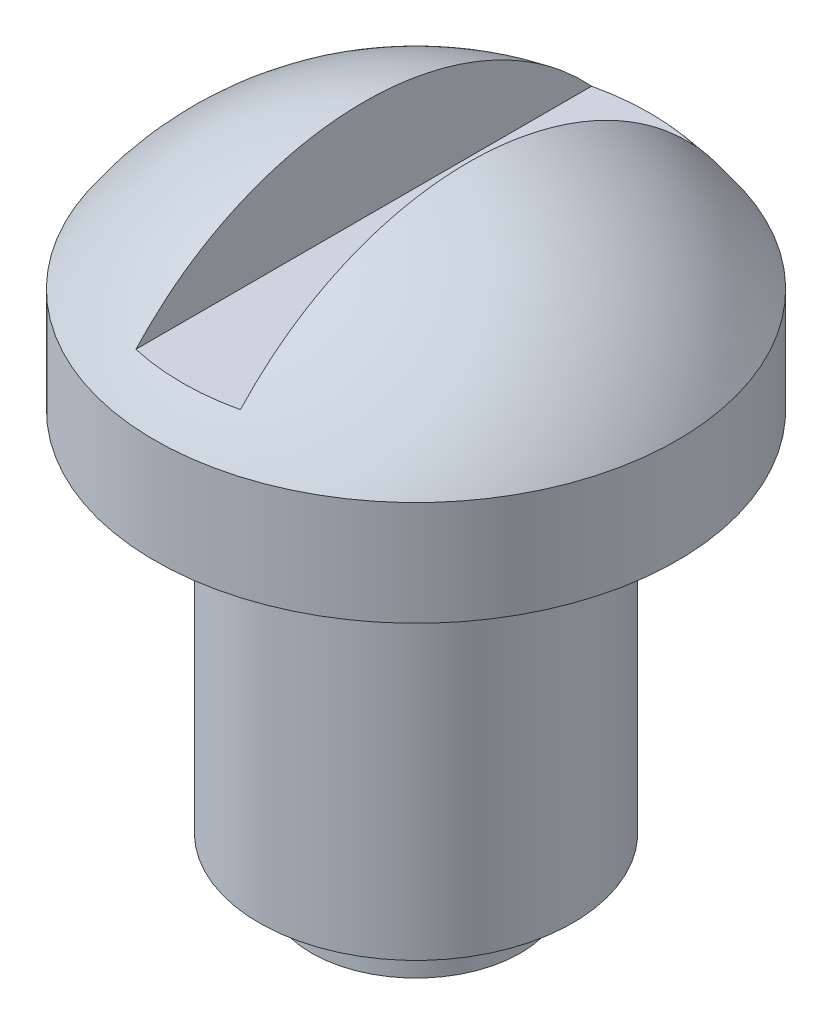
from build123d import *

# Parameters (mm, degrees)
SKETCH3_W          = 2
SKETCH3_H          = 4
CUT_EXTRUDE1_DEPTH = 5


with BuildPart() as part:
    # Sketch2 → Revolve1 (revolve)
    with BuildSketch(Plane.XY, mode=Mode.PRIVATE) as revolve1_sk:
        with BuildLine():
            Line((0, 0), (0, -12.68337521))
            Line((0, -12.68337521), (2, -12.68337521))
            Line((2, -12.68337521), (2, -11.68337521))
            Line((2, -11.68337521), (3, -11.68337521))
            Line((3, -11.68337521), (3, -4.68337521))
            Line((3, -4.68337521), (5, -4.68337521))
            Line((5, -4.68337521), (5, -2.68337521))
            ThreePointArc((5, -2.68337521), (2.837274331, -0.713235926), (0, 0))
        make_face()
    revolve(revolve1_sk.sketch.rotate(Axis((0, 0, 0), (0, -1, 0)), 180), axis=Axis((0, 0, 0), (0, -1, 0)))

    # Sketch3 → Cut-Extrude1 (cut, symmetric)
    with BuildSketch(Plane.XY):
        Rectangle(SKETCH3_W, SKETCH3_H)
    extrude(amount=CUT_EXTRUDE1_DEPTH, both=True, mode=Mode.SUBTRACT)


solid = part.part
